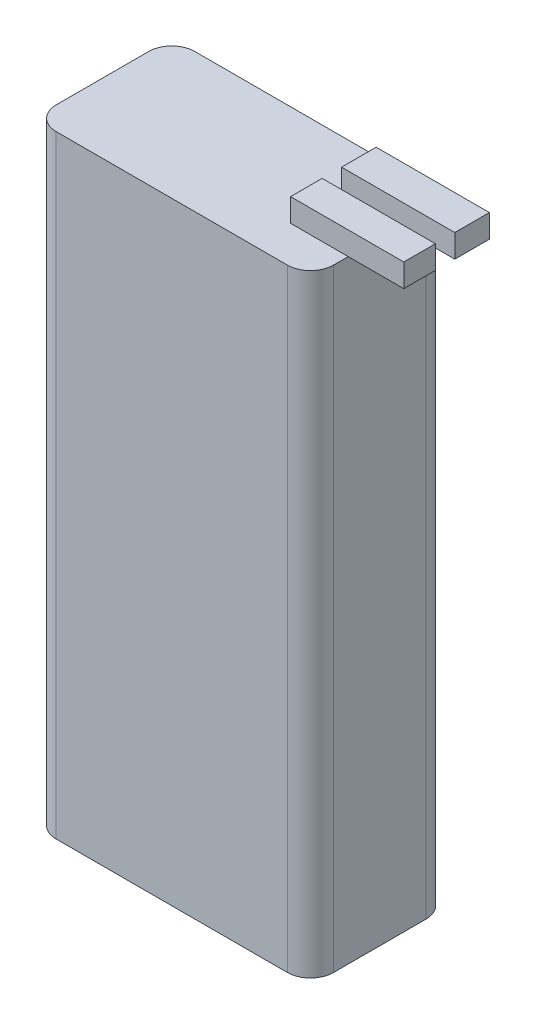
from build123d import *

# Parameters (mm, degrees)
BOSS_EXTRUDE1_DEPTH = 53
SKETCH2_W           = 9.792899242
SKETCH2_H           = 2.993116411
SKETCH2_H_2         = 2.732466193
BOSS_EXTRUDE2_DEPTH = 2


with BuildPart() as part:
    # Sketch1 → Boss-Extrude1 (new body)
    with BuildSketch(Plane(origin=(0, 0, 0), x_dir=(1, 0, 0), z_dir=(0, 1, 0))):
        with BuildLine():
            Line((-10, 6), (10, 6))
            ThreePointArc((10, 6), (11.414213562, 5.414213562), (12, 4))
            Line((12, 4), (12, -4))
            ThreePointArc((12, -4), (11.414213562, -5.414213562), (10, -6))
            Line((10, -6), (-10, -6))
            ThreePointArc((-10, -6), (-11.414213562, -5.414213562), (-12, -4))
            Line((-12, -4), (-12, 4))
            ThreePointArc((-12, 4), (-11.414213562, 5.414213562), (-10, 6))
        make_face()
    extrude(amount=BOSS_EXTRUDE1_DEPTH)

    # Sketch2 → Boss-Extrude2 (add)
    with BuildSketch(Plane(origin=(0, 53, 0), x_dir=(1, 0, 0), z_dir=(0, 1, 0))):
        with Locations((11.907689601, 3.176051955)):
            Rectangle(SKETCH2_W, SKETCH2_H)
        with Locations((11.907689601, -1.366233097)):
            Rectangle(SKETCH2_W, SKETCH2_H_2)
    extrude(amount=BOSS_EXTRUDE2_DEPTH)


solid = part.part
